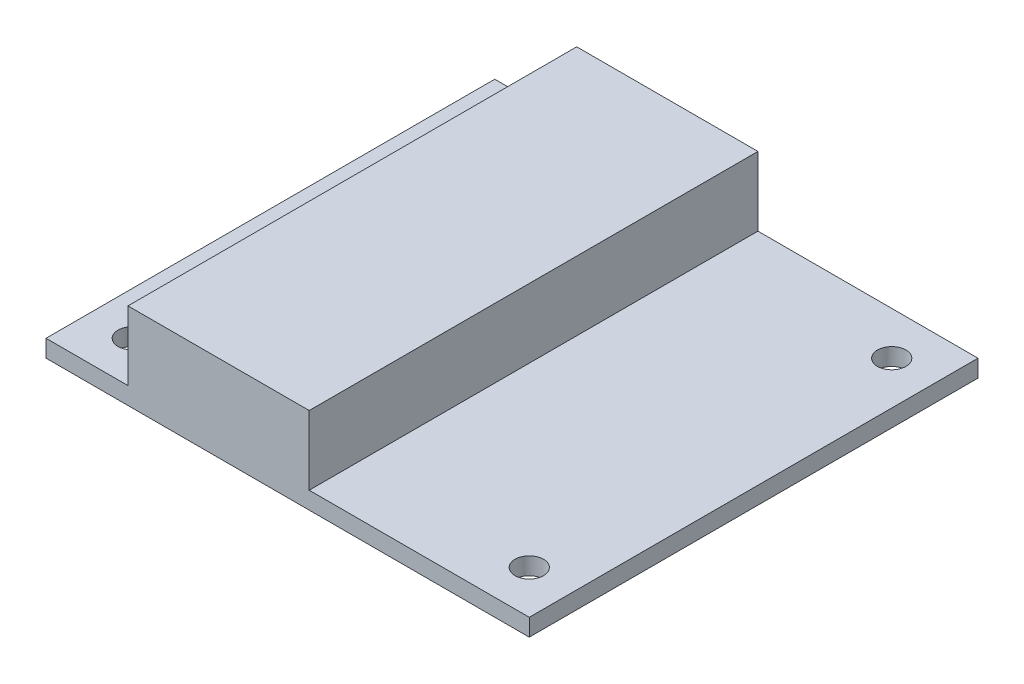
from build123d import *

# Parameters (mm, degrees)
SKETCH2_W           = 56
SKETCH2_H           = 52
BOSS_EXTRUDE1_DEPTH = 2
SKETCH3_R           = 1.65
CUT_EXTRUDE1_DEPTH  = 77.446059414
SKETCH4_W           = 21
SKETCH4_H           = 52
BOSS_EXTRUDE2_DEPTH = 8


with BuildPart() as part:
    # Sketch2 → Boss-Extrude1 (new body)
    with BuildSketch(Plane(origin=(0, 0, 0), x_dir=(1, 0, 0), z_dir=(0, 1, 0))):
        with Locations((28, 26)):
            Rectangle(SKETCH2_W, SKETCH2_H)
    extrude(amount=BOSS_EXTRUDE1_DEPTH)

    # Sketch3 → Cut-Extrude1 (cut, through all)
    with BuildSketch(Plane(origin=(0, 2, 0), x_dir=(1, 0, 0), z_dir=(0, 1, 0))):
        with Locations(Location((5, 47, 0), (0, 0, 270))):
            Circle(SKETCH3_R)
        with Locations(Location((51, 47, 0), (0, 0, 270))):
            Circle(SKETCH3_R)
        with Locations(Location((5, 5, 0), (0, 0, 270))):
            Circle(SKETCH3_R)
        with Locations(Location((51, 5, 0), (0, 0, 270))):
            Circle(SKETCH3_R)
    extrude(amount=-CUT_EXTRUDE1_DEPTH, mode=Mode.SUBTRACT)

    # Sketch4 → Boss-Extrude2 (add)
    with BuildSketch(Plane(origin=(0, 2, 0), x_dir=(1, 0, 0), z_dir=(0, 1, 0))):
        with Locations((20, 26)):
            Rectangle(SKETCH4_W, SKETCH4_H)
    extrude(amount=BOSS_EXTRUDE2_DEPTH)


solid = part.part
